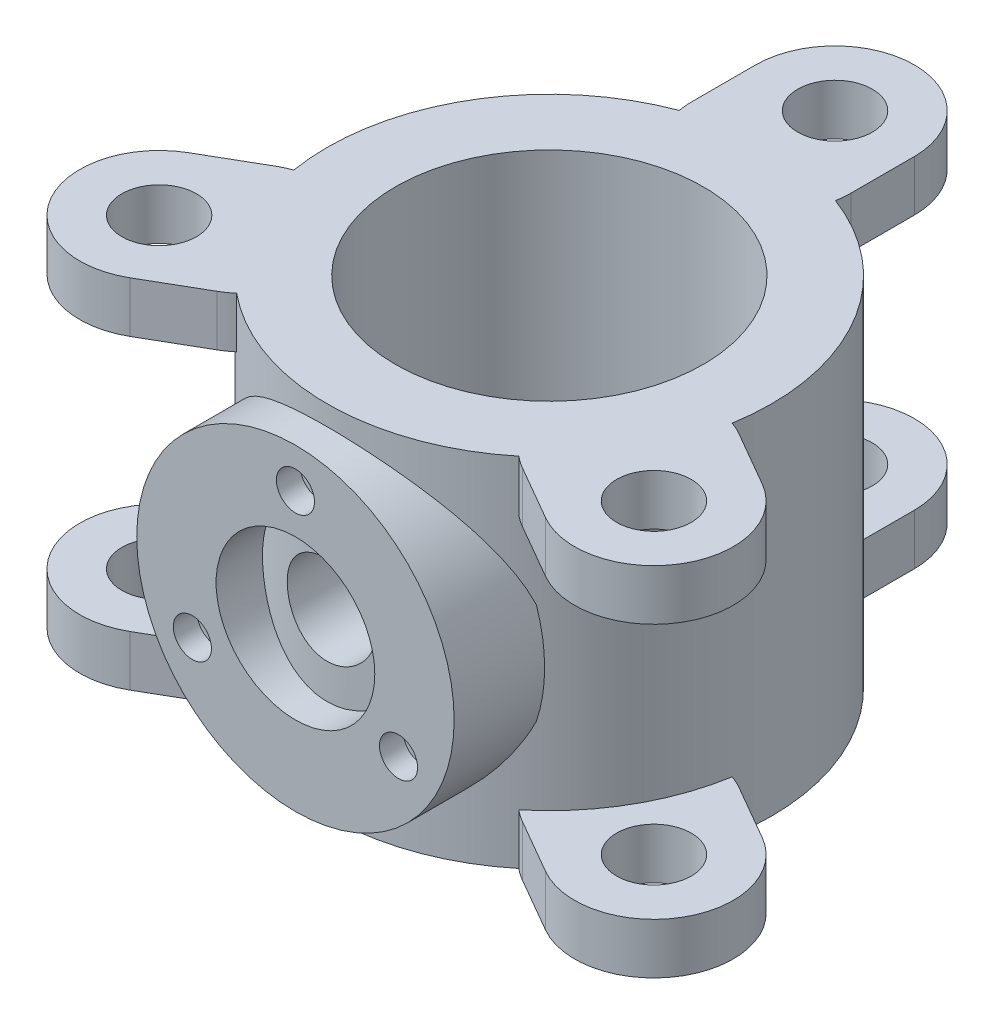
from build123d import *

# Parameters (mm, degrees)
SKETCH1_R                = 140
SKETCH1_R_2              = 97
BOSS_EXTRUDE1_DEPTH      = 225
SKETCH2_R                = 23.5
BOSS_EXTRUDE2_DEPTH      = 32
CUT_EXTRUDE3_REACH       = 481.493
SKETCH8_R                = 28
BOSS_EXTRUDE4_DEPTH      = 20
BOSS_EXTRUDE4_DEPTH_BACK = 37
SKETCH9_R                = 100
SKETCH9_R_2              = 50
SKETCH10_R               = 12
CUT_EXTRUDE4_DEPTH       = 20
SKETCH10_2_R             = 12
BOSS_EXTRUDE5_DEPTH      = 5


with BuildPart() as part:
    # Sketch1 → Boss-Extrude1 (new body)
    with BuildSketch(Plane(origin=(0, 0, 0), x_dir=(1, 0, 0), z_dir=(0, 1, 0))):
        Circle(SKETCH1_R)
        Circle(SKETCH1_R_2, mode=Mode.SUBTRACT)
    boss_extrude1 = extrude(amount=-BOSS_EXTRUDE1_DEPTH)

    # Sketch2 → Boss-Extrude2 (add)
    # profile 1 of 3: a face of its own
    with BuildSketch(Plane(origin=(0, 0, 0), x_dir=(1, 0, 0), z_dir=(0, 1, 0))):
        with BuildLine():
            Line((50, 180), (50, 140))
            ThreePointArc((50, 140), (46.560641243, 121.776205471), (36.715732519, 106.059537635))
            Line((36.715732519, 106.059537635), (-36.715732519, 106.059537635))
            ThreePointArc((-36.715732519, 106.059537635), (-46.560641243, 121.776205471), (-50, 140))
            Line((-50, 140), (-50, 180))
            ThreePointArc((-50, 180), (0, 230), (50, 180))
        make_face()
        with Locations((0, 180)):
            Circle(SKETCH2_R, mode=Mode.SUBTRACT)
    # profile 2 of 3: a face of its own
    with BuildSketch(Plane(origin=(0, 0, 0), x_dir=(1, 0, 0), z_dir=(0, 1, 0))):
        with BuildLine():
            Line((110.208120165, -21.233011737), (73.492387646, -84.826525898))
            ThreePointArc((73.492387646, -84.826525898), (82.180966893, -101.210800869), (96.24355653, -113.301270189))
            Line((96.24355653, -113.301270189), (130.884572681, -133.301270189))
            ThreePointArc((130.884572681, -133.301270189), (199.18584287, -115), (180.884572681, -46.698729811))
            Line((180.884572681, -46.698729811), (146.24355653, -26.698729811))
            ThreePointArc((146.24355653, -26.698729811), (128.741608136, -20.565404603), (110.208120165, -21.233011737))
        make_face()
        with Locations((155.884572681, -90)):
            Circle(SKETCH2_R, mode=Mode.SUBTRACT)
    # profile 3 of 3: a face of its own
    with BuildSketch(Plane(origin=(0, 0, 0), x_dir=(1, 0, 0), z_dir=(0, 1, 0))):
        with BuildLine():
            Line((-73.492387646, -84.826525898), (-110.208120165, -21.233011737))
            ThreePointArc((-110.208120165, -21.233011737), (-128.741608136, -20.565404603), (-146.24355653, -26.698729811))
            Line((-146.24355653, -26.698729811), (-180.884572681, -46.698729811))
            ThreePointArc((-180.884572681, -46.698729811), (-199.18584287, -115), (-130.884572681, -133.301270189))
            Line((-130.884572681, -133.301270189), (-96.24355653, -113.301270189))
            ThreePointArc((-96.24355653, -113.301270189), (-82.180966893, -101.210800869), (-73.492387646, -84.826525898))
        make_face()
        with Locations((-155.884572681, -90)):
            Circle(SKETCH2_R, mode=Mode.SUBTRACT)
    boss_extrude2 = extrude(amount=-BOSS_EXTRUDE2_DEPTH)

    # Mirror1: Boss-Extrude1, Boss-Extrude2 across plane
    add(boss_extrude1.mirror(Plane(origin=(0, -112.5, 0), x_dir=(0, 0, 1), z_dir=(0, -1, 0))))
    add(boss_extrude2.mirror(Plane(origin=(0, -112.5, 0), x_dir=(0, 0, 1), z_dir=(0, -1, 0))))

    # Sketch8 → Cut-Extrude3 (cut, up to next)
    with BuildSketch(Plane.XY.offset(140), mode=Mode.PRIVATE) as cut_extrude3_sk1:
        with Locations((0, -112.5)):
            Circle(SKETCH8_R)
    cut_extrude3_tool1 = extrude(cut_extrude3_sk1.sketch, amount=-CUT_EXTRUDE3_REACH, mode=Mode.PRIVATE) & part.part
    add(cut_extrude3_tool1.solids().sort_by_distance((0, -112.5, 140))[0], mode=Mode.SUBTRACT)

    # Sketch9 → Boss-Extrude4 (add, two sides: drawn at the far end of the back side and taken through both)
    with BuildSketch(Plane.XY.offset(140).offset(-BOSS_EXTRUDE4_DEPTH_BACK)):
        with Locations((0, -112.5)):
            Circle(SKETCH9_R)
        with Locations((0, -112.5)):
            Circle(SKETCH9_R_2, mode=Mode.SUBTRACT)
    extrude(amount=BOSS_EXTRUDE4_DEPTH + BOSS_EXTRUDE4_DEPTH_BACK)

    # Sketch10 → Cut-Extrude4 (cut)
    with BuildSketch(Plane.XY.offset(140)):
        with Locations((0, -37.5)):
            Circle(SKETCH10_R)
        with Locations((64.951905284, -150)):
            Circle(SKETCH10_R)
        with Locations((-64.951905284, -150)):
            Circle(SKETCH10_R)
    extrude(amount=CUT_EXTRUDE4_DEPTH, mode=Mode.SUBTRACT)

    # Sketch10<2> → Boss-Extrude5 (add)
    with BuildSketch(Plane.XY.offset(140)):
        with Locations((0, -37.5)):
            Circle(SKETCH10_2_R)
        with Locations((64.951905284, -150)):
            Circle(SKETCH10_2_R)
        with Locations((-64.951905284, -150)):
            Circle(SKETCH10_2_R)
    extrude(amount=BOSS_EXTRUDE5_DEPTH)


solid = part.part
